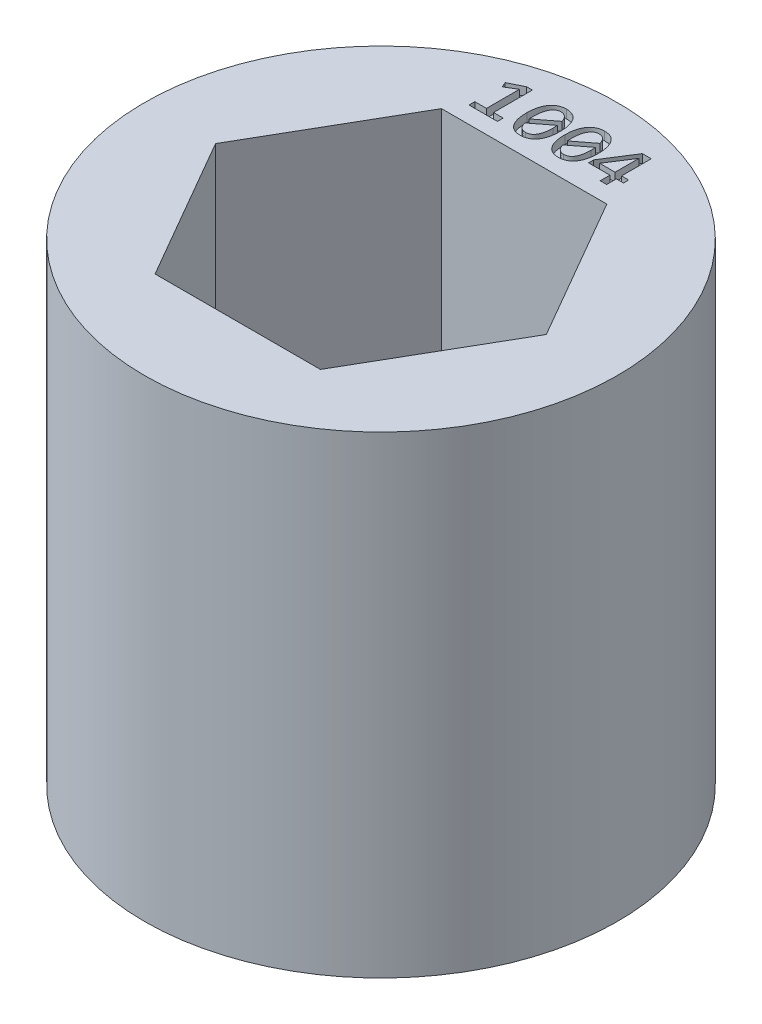
from build123d import *

# Parameters (mm, degrees)
SKETCH1_R           = 11.1125
BOSS_EXTRUDE1_DEPTH = 22.225
CUT_EXTRUDE1_DEPTH  = 0.4


with BuildPart() as part:
    # Sketch1 → Boss-Extrude1 (new body)
    with BuildSketch(Plane(origin=(0, 0, 0), x_dir=(1, 0, 0), z_dir=(0, 1, 0))):
        with Locations(Location((0, 0, 0), (0, 0, 270))):
            Circle(SKETCH1_R)
        Polygon((7.772289324, 0), (3.886144662, 6.731), (-3.886144662, 6.731), (-7.772289324, 0), (-3.886144662, -6.731), (3.886144662, -6.731), align=None, mode=Mode.SUBTRACT)
    extrude(amount=BOSS_EXTRUDE1_DEPTH)

    # Sketch2 → Cut-Extrude1 (cut)
    # profile 1 of 4: a face of its own
    with BuildSketch(Plane(origin=(0, 22.225, 0), x_dir=(1, 0, 0), z_dir=(0, 1, 0))):
        Polygon((-2.049251493, 7.52475), (-3.385828712, 7.52475), (-3.385828712, 7.798140795), (-2.839047122, 7.798140795), (-2.839047122, 9.347355299), (-3.343586037, 9.043587749), (-3.446582222, 9.286601789), (-2.776395065, 9.620746094), (-2.504902817, 9.620746094), (-2.504902817, 7.798140795), (-2.049251493, 7.798140795), align=None)
    # profile 2 of 4: a face of its own
    with BuildSketch(Plane(origin=(0, 22.225, 0), x_dir=(1, 0, 0), z_dir=(0, 1, 0))):
        with BuildLine():
            add(Edge.make_bspline(
                [(-0.165892684, 8.571798773), (-0.166325651, 8.532539667), (-0.167173732, 8.455640449), (-0.177140738, 8.343154692), (-0.192029215, 8.235790499), (-0.213292587, 8.133952321), (-0.240272581, 8.037990717), (-0.274910407, 7.94907057), (-0.314865217, 7.866804514), (-0.36154288, 7.791798506), (-0.414321619, 7.724560589), (-0.47324158, 7.664946723), (-0.538399911, 7.613533187), (-0.609814661, 7.570502981), (-0.68721939, 7.535730504), (-0.771505487, 7.511991642), (-0.861946132, 7.496719325), (-0.924455141, 7.495170599), (-0.956637587, 7.494373245)],
                knots=[0, 0, 0, 0, 1.248871528, 2.446241243, 3.590357027, 4.69618527, 5.754202854, 6.758290001, 7.728669934, 8.660396172, 9.563796911, 10.443071522, 11.321307858, 12.197637495, 13.090115231, 14.012601613, 14.976798049, 16, 16, 16, 16], degree=3))
            add(Edge.make_bspline(
                [(-0.956637587, 7.494373245), (-0.984523883, 7.495052085), (-1.039450838, 7.49638918), (-1.119857224, 7.508449964), (-1.196306294, 7.528578979), (-1.268936867, 7.555832092), (-1.33687734, 7.592268051), (-1.399769911, 7.637185139), (-1.457884215, 7.690364794), (-1.510227055, 7.752740329), (-1.557317942, 7.823677829), (-1.598168065, 7.90395186), (-1.633485499, 7.992818781), (-1.663637227, 8.090645609), (-1.686393921, 8.197912899), (-1.703489664, 8.314242635), (-1.713327632, 8.43999634), (-1.714500293, 8.526849228), (-1.715107188, 8.571798773)],
                knots=[0, 0, 0, 0, 0.897102697, 1.767001224, 2.609309556, 3.43771295, 4.257811968, 5.082953918, 5.919052252, 6.786174452, 7.6970727, 8.653553743, 9.679470751, 10.771494031, 11.944028827, 13.204944144, 14.553456404, 16, 16, 16, 16], degree=3))
            add(Edge.make_bspline(
                [(-1.715107188, 8.571798773), (-1.71439973, 8.61105018), (-1.713011452, 8.688075074), (-1.704182638, 8.80098373), (-1.688450082, 8.908608048), (-1.666850285, 9.010640269), (-1.638993202, 9.106716551), (-1.604965465, 9.195993499), (-1.56504748, 9.278286577), (-1.518887126, 9.353393458), (-1.466343023, 9.420893929), (-1.407260963, 9.480522767), (-1.342058547, 9.532107187), (-1.270210211, 9.574984835), (-1.192479257, 9.609682096), (-1.108222811, 9.633455575), (-1.01826503, 9.648757906), (-0.956228477, 9.650320298), (-0.924362285, 9.651122849)],
                knots=[0, 0, 0, 0, 1.248165713, 2.449334701, 3.598380242, 4.704508407, 5.763215836, 6.776019403, 7.739017366, 8.667464557, 9.574217704, 10.452902578, 11.330549874, 12.210601904, 13.107080692, 14.028948355, 14.987533857, 16, 16, 16, 16], degree=3))
            add(Edge.make_bspline(
                [(-0.924362285, 9.651122849), (-0.896475332, 9.65044401), (-0.841547085, 9.649106917), (-0.761301786, 9.637068879), (-0.684906628, 9.616988523), (-0.612566496, 9.588928446), (-0.544255062, 9.55306767), (-0.481529832, 9.507650243), (-0.423570481, 9.4541749), (-0.371366128, 9.391384812), (-0.324102603, 9.320190323), (-0.282877316, 9.240086592), (-0.247896786, 9.150892646), (-0.21811261, 9.053170973), (-0.194357973, 8.94609034), (-0.177578445, 8.829814678), (-0.16764054, 8.703922163), (-0.166489433, 8.616908067), (-0.165892684, 8.571798773)],
                knots=[0, 0, 0, 0, 0.896490568, 1.765795528, 2.602608418, 3.432274242, 4.256303472, 5.076742829, 5.915718828, 6.786140009, 7.696416714, 8.659101079, 9.677705081, 10.773848187, 11.941709476, 13.20176442, 14.549356535, 16, 16, 16, 16], degree=3))
        make_face()
        with BuildLine():
            add(Edge.make_bspline(
                [(-0.469660234, 8.555661122), (-0.469767537, 8.573863715), (-0.469981394, 8.610141868), (-0.474024404, 8.66420242), (-0.477403908, 8.717562964), (-0.480799232, 8.752800822), (-0.482475427, 8.770196954)],
                knots=[0, 0, 0, 0, 1.015676625, 2.024265076, 3.024624451, 4, 4, 4, 4], degree=3))
            Line((-0.482475427, 8.770196954), (-1.352010038, 8.101908345))
            add(Edge.make_bspline(
                [(-1.352010038, 8.101908345), (-1.34345071, 8.076265996), (-1.326662373, 8.025970882), (-1.294265101, 7.955066462), (-1.254555089, 7.89173888), (-1.206818183, 7.837824622), (-1.151314915, 7.794527876), (-1.099629529, 7.766900506), (-1.054544191, 7.751966897), (-1.018409114, 7.743163446), (-0.979846281, 7.738703342), (-0.953482359, 7.737832032), (-0.940025299, 7.737387285)],
                knots=[0, 0, 0, 0, 1.361870802, 2.671184605, 3.91877896, 5.116024374, 6.280451232, 7.450298556, 8.047911377, 8.670688444, 9.321473259, 10, 10, 10, 10], degree=3))
            add(Edge.make_bspline(
                [(-0.940025299, 7.737387285), (-0.922568023, 7.737990031), (-0.888151282, 7.739178334), (-0.837940335, 7.749690283), (-0.790019018, 7.765595868), (-0.744956902, 7.788922519), (-0.702437868, 7.81819234), (-0.664088949, 7.855043255), (-0.627980083, 7.897005683), (-0.595887758, 7.945833557), (-0.56696193, 8.000716962), (-0.54122657, 8.061797586), (-0.519690508, 8.129212654), (-0.501773845, 8.20284563), (-0.487029219, 8.282354818), (-0.476801204, 8.368116723), (-0.470554024, 8.459848262), (-0.469964364, 8.523058842), (-0.469660234, 8.555661122)],
                knots=[0, 0, 0, 0, 0.796240393, 1.569775284, 2.332781704, 3.095240773, 3.878796528, 4.681173991, 5.516437293, 6.40201063, 7.34239963, 8.345981007, 9.424260963, 10.57011489, 11.804224653, 13.114209461, 14.5115885, 16, 16, 16, 16], degree=3))
        make_face(mode=Mode.SUBTRACT)
        with BuildLine():
            add(Edge.make_bspline(
                [(-1.411339638, 8.575121231), (-1.411359377, 8.558192429), (-1.411398856, 8.524334087), (-1.411104532, 8.473852915), (-1.409430028, 8.424119907), (-1.406576912, 8.391427549), (-1.40516936, 8.375299139)],
                knots=[0, 0, 0, 0, 1.015676347, 2.03139705, 3.028811753, 4, 4, 4, 4], degree=3))
            Line((-1.40516936, 8.375299139), (-0.535160112, 9.043587749))
            add(Edge.make_bspline(
                [(-0.535160112, 9.043587749), (-0.543388282, 9.06962101), (-0.55938939, 9.120247212), (-0.593277284, 9.190237885), (-0.631981209, 9.253403948), (-0.679714875, 9.306455436), (-0.733736714, 9.350825781), (-0.785361246, 9.377733147), (-0.829524865, 9.3935938), (-0.864965959, 9.402303753), (-0.902414282, 9.406781166), (-0.927991087, 9.407661784), (-0.940974573, 9.408108809)],
                knots=[0, 0, 0, 0, 1.387569518, 2.698370158, 3.946895934, 5.144331536, 6.312393877, 7.486406228, 8.084826247, 8.697958228, 9.339048001, 10, 10, 10, 10], degree=3))
            add(Edge.make_bspline(
                [(-0.940974573, 9.408108809), (-0.958425679, 9.407488034), (-0.992830258, 9.406264186), (-1.04303389, 9.396031422), (-1.090739, 9.379139534), (-1.13598574, 9.355773608), (-1.178581811, 9.325843448), (-1.217031274, 9.288351162), (-1.253677288, 9.245695765), (-1.285520627, 9.19530522), (-1.314500544, 9.139278924), (-1.339775267, 9.076800562), (-1.361156549, 9.008131554), (-1.379940417, 8.933425934), (-1.393792523, 8.852471795), (-1.404251708, 8.765520689), (-1.410428728, 8.672353508), (-1.411029772, 8.60819695), (-1.411339638, 8.575121231)],
                knots=[0, 0, 0, 0, 0.786453526, 1.550480632, 2.299704824, 3.062398082, 3.840423392, 4.637837687, 5.478332318, 6.370910143, 7.318703432, 8.320397478, 9.40580758, 10.560070273, 11.791787257, 13.106920475, 14.508481623, 16, 16, 16, 16], degree=3))
        make_face(mode=Mode.SUBTRACT)
    # profile 3 of 4: a face of its own
    with BuildSketch(Plane(origin=(0, 22.225, 0), x_dir=(1, 0, 0), z_dir=(0, 1, 0))):
        with BuildLine():
            add(Edge.make_bspline(
                [(1.62633586, 8.571798773), (1.625902893, 8.532539667), (1.625054812, 8.455640449), (1.615087806, 8.343154692), (1.600199328, 8.235790499), (1.578935957, 8.133952321), (1.551955963, 8.037990717), (1.517318137, 7.94907057), (1.477363327, 7.866804514), (1.430685663, 7.791798506), (1.377906925, 7.724560589), (1.318986964, 7.664946723), (1.253828633, 7.613533187), (1.182413883, 7.570502981), (1.105009154, 7.535730504), (1.020723057, 7.511991642), (0.930282412, 7.496719325), (0.867773403, 7.495170599), (0.835590957, 7.494373245)],
                knots=[0, 0, 0, 0, 1.248871528, 2.446241243, 3.590357027, 4.69618527, 5.754202854, 6.758290001, 7.728669934, 8.660396172, 9.563796911, 10.443071522, 11.321307858, 12.197637495, 13.090115231, 14.012601613, 14.976798049, 16, 16, 16, 16], degree=3))
            add(Edge.make_bspline(
                [(0.835590957, 7.494373245), (0.807704661, 7.495052085), (0.752777706, 7.49638918), (0.67237132, 7.508449964), (0.59592225, 7.528578979), (0.523291677, 7.555832092), (0.455351204, 7.592268051), (0.392458633, 7.637185139), (0.334344328, 7.690364794), (0.282001489, 7.752740329), (0.234910602, 7.823677829), (0.194060479, 7.90395186), (0.158743045, 7.992818781), (0.128591317, 8.090645609), (0.105834623, 8.197912899), (0.08873888, 8.314242635), (0.078900912, 8.43999634), (0.077728251, 8.526849228), (0.077121356, 8.571798773)],
                knots=[0, 0, 0, 0, 0.897102697, 1.767001224, 2.609309556, 3.43771295, 4.257811968, 5.082953918, 5.919052252, 6.786174452, 7.6970727, 8.653553743, 9.679470751, 10.771494031, 11.944028827, 13.204944144, 14.553456404, 16, 16, 16, 16], degree=3))
            add(Edge.make_bspline(
                [(0.077121356, 8.571798773), (0.077828814, 8.61105018), (0.079217092, 8.688075074), (0.088045906, 8.80098373), (0.103778462, 8.908608048), (0.125378259, 9.010640269), (0.153235342, 9.106716551), (0.187263079, 9.195993499), (0.227181064, 9.278286577), (0.273341418, 9.353393458), (0.325885521, 9.420893929), (0.384967581, 9.480522767), (0.450169997, 9.532107187), (0.522018333, 9.574984835), (0.599749287, 9.609682096), (0.684005733, 9.633455575), (0.773963514, 9.648757906), (0.836000067, 9.650320298), (0.867866259, 9.651122849)],
                knots=[0, 0, 0, 0, 1.248165713, 2.449334701, 3.598380242, 4.704508407, 5.763215836, 6.776019403, 7.739017366, 8.667464557, 9.574217704, 10.452902578, 11.330549874, 12.210601904, 13.107080692, 14.028948355, 14.987533857, 16, 16, 16, 16], degree=3))
            add(Edge.make_bspline(
                [(0.867866259, 9.651122849), (0.895753212, 9.65044401), (0.950681459, 9.649106917), (1.030926758, 9.637068879), (1.107321916, 9.616988523), (1.179662048, 9.588928446), (1.247973482, 9.55306767), (1.310698712, 9.507650243), (1.368658063, 9.4541749), (1.420862416, 9.391384812), (1.468125941, 9.320190323), (1.509351228, 9.240086592), (1.544331758, 9.150892646), (1.574115934, 9.053170973), (1.597870571, 8.94609034), (1.614650099, 8.829814678), (1.624588004, 8.703922163), (1.625739111, 8.616908067), (1.62633586, 8.571798773)],
                knots=[0, 0, 0, 0, 0.896490568, 1.765795528, 2.602608418, 3.432274242, 4.256303472, 5.076742829, 5.915718828, 6.786140009, 7.696416714, 8.659101079, 9.677705081, 10.773848187, 11.941709476, 13.20176442, 14.549356535, 16, 16, 16, 16], degree=3))
        make_face()
        with BuildLine():
            add(Edge.make_bspline(
                [(1.32256831, 8.555661122), (1.322461007, 8.573863715), (1.322247149, 8.610141868), (1.31820414, 8.66420242), (1.314824636, 8.717562964), (1.311429311, 8.752800822), (1.309753117, 8.770196954)],
                knots=[0, 0, 0, 0, 1.015676625, 2.024265076, 3.024624451, 4, 4, 4, 4], degree=3))
            Line((1.309753117, 8.770196954), (0.440218505, 8.101908345))
            add(Edge.make_bspline(
                [(0.440218505, 8.101908345), (0.448777834, 8.076265996), (0.465566171, 8.025970882), (0.497963443, 7.955066462), (0.537673455, 7.89173888), (0.585410361, 7.837824622), (0.640913629, 7.794527876), (0.692599015, 7.766900506), (0.737684353, 7.751966897), (0.77381943, 7.743163446), (0.812382263, 7.738703342), (0.838746185, 7.737832032), (0.852203245, 7.737387285)],
                knots=[0, 0, 0, 0, 1.361870802, 2.671184605, 3.91877896, 5.116024374, 6.280451232, 7.450298556, 8.047911377, 8.670688444, 9.321473259, 10, 10, 10, 10], degree=3))
            add(Edge.make_bspline(
                [(0.852203245, 7.737387285), (0.86966052, 7.737990031), (0.904077262, 7.739178334), (0.954288209, 7.749690283), (1.002209526, 7.765595868), (1.047271642, 7.788922519), (1.089790676, 7.81819234), (1.128139595, 7.855043255), (1.164248461, 7.897005683), (1.196340786, 7.945833557), (1.225266614, 8.000716962), (1.251001974, 8.061797586), (1.272538036, 8.129212654), (1.290454699, 8.20284563), (1.305199325, 8.282354818), (1.31542734, 8.368116723), (1.32167452, 8.459848262), (1.32226418, 8.523058842), (1.32256831, 8.555661122)],
                knots=[0, 0, 0, 0, 0.796240393, 1.569775284, 2.332781704, 3.095240773, 3.878796528, 4.681173991, 5.516437293, 6.40201063, 7.34239963, 8.345981007, 9.424260963, 10.57011489, 11.804224653, 13.114209461, 14.5115885, 16, 16, 16, 16], degree=3))
        make_face(mode=Mode.SUBTRACT)
        with BuildLine():
            add(Edge.make_bspline(
                [(0.380888906, 8.575121231), (0.380869167, 8.558192429), (0.380829688, 8.524334087), (0.381124012, 8.473852915), (0.382798516, 8.424119907), (0.385651632, 8.391427549), (0.387059184, 8.375299139)],
                knots=[0, 0, 0, 0, 1.015676347, 2.03139705, 3.028811753, 4, 4, 4, 4], degree=3))
            Line((0.387059184, 8.375299139), (1.257068432, 9.043587749))
            add(Edge.make_bspline(
                [(1.257068432, 9.043587749), (1.248840262, 9.06962101), (1.232839154, 9.120247212), (1.19895126, 9.190237885), (1.160247335, 9.253403948), (1.112513669, 9.306455436), (1.05849183, 9.350825781), (1.006867298, 9.377733147), (0.962703679, 9.3935938), (0.927262585, 9.402303753), (0.889814262, 9.406781166), (0.864237457, 9.407661784), (0.851253971, 9.408108809)],
                knots=[0, 0, 0, 0, 1.387569518, 2.698370158, 3.946895934, 5.144331536, 6.312393877, 7.486406228, 8.084826247, 8.697958228, 9.339048001, 10, 10, 10, 10], degree=3))
            add(Edge.make_bspline(
                [(0.851253971, 9.408108809), (0.833802865, 9.407488034), (0.799398286, 9.406264186), (0.749194653, 9.396031422), (0.701489544, 9.379139534), (0.656242804, 9.355773608), (0.613646733, 9.325843448), (0.57519727, 9.288351162), (0.538551256, 9.245695765), (0.506707917, 9.19530522), (0.477728, 9.139278924), (0.452453277, 9.076800562), (0.431071995, 9.008131554), (0.412288127, 8.933425934), (0.398436021, 8.852471795), (0.387976836, 8.765520689), (0.381799816, 8.672353508), (0.381198772, 8.60819695), (0.380888906, 8.575121231)],
                knots=[0, 0, 0, 0, 0.786453526, 1.550480632, 2.299704824, 3.062398082, 3.840423392, 4.637837687, 5.478332318, 6.370910143, 7.318703432, 8.320397478, 9.40580758, 10.560070273, 11.791787257, 13.106920475, 14.508481623, 16, 16, 16, 16], degree=3))
        make_face(mode=Mode.SUBTRACT)
    # profile 4 of 4: a face of its own
    with BuildSketch(Plane(origin=(0, 22.225, 0), x_dir=(1, 0, 0), z_dir=(0, 1, 0))):
        Polygon((3.418564404, 7.980401325), (3.084420099, 7.980401325), (3.084420099, 7.52475), (2.780652549, 7.52475), (2.780652549, 7.980401325), (1.778219635, 7.980401325), (1.778219635, 8.223415365), (2.665315808, 9.620746094), (3.084420099, 9.620746094), (3.084420099, 8.223415365), (3.418564404, 8.223415365), align=None)
        Polygon((2.780652549, 9.35020312), (2.056831435, 8.223415365), (2.780652549, 8.223415365), align=None, mode=Mode.SUBTRACT)
    extrude(amount=-CUT_EXTRUDE1_DEPTH, mode=Mode.SUBTRACT)


solid = part.part
